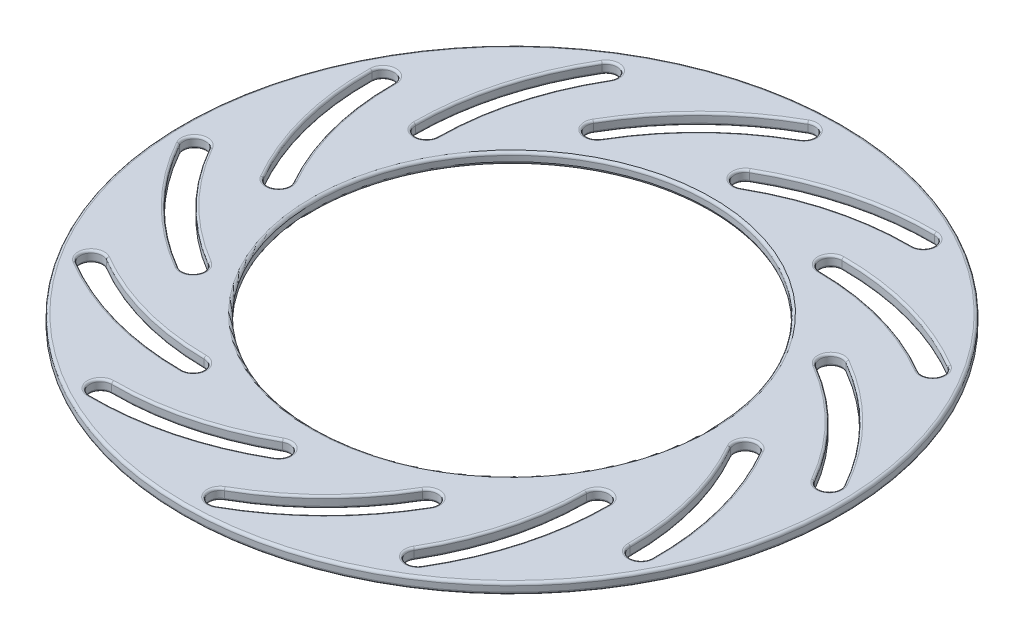
from build123d import *

# Parameters (mm, degrees)
SKETCH_1_R                       = 60
SKETCH_1_R_2                     = 36
EXTRUDE_1_DEPTH                  = 1
CUT_EXTRUDE_1_DEPTH              = 85.876380696
FILLET_2_R                       = 0.4
PATTERN_CIRCULAR_1_COUNT         = 12
FILLET_2_OF_PATTERN_CIRCULAR_1_R = 0.4
FILLET_1_R                       = 0.5


with BuildPart() as part:
    # Эскиз1 → Бобышка-Вытянуть1 (new, symmetric)
    with BuildSketch(Plane(origin=(0, 0, 0), x_dir=(1, 0, 0), z_dir=(0, 1, 0))):
        with Locations(Location((0, 0, 0), (0, 0, 270))):
            Circle(SKETCH_1_R)
        with Locations(Location((0, 0, 0), (0, 0, 270))):
            Circle(SKETCH_1_R_2, mode=Mode.SUBTRACT)
    extrude(amount=EXTRUDE_1_DEPTH, both=True)

    # Эскиз2 → Вырез-Вытянуть1 (cut, through all)
    with BuildSketch(Plane(origin=(0, 1, 0), x_dir=(1, 0, 0), z_dir=(0, 1, 0))):
        with BuildLine():
            ThreePointArc((-1, 44.232050808), (-1.734695442, 41.504594694), (0.990803619, 40.762672112))
            ThreePointArc((0.990803619, 40.762672112), (12.908045968, 45.613674132), (25.677365486, 47.193979435))
            ThreePointArc((25.677365486, 47.193979435), (27.694418732, 49.171424871), (25.722326885, 51.193712683))
            ThreePointArc((25.722326885, 51.193712683), (11.890599802, 49.519139452), (-1, 44.232050808))
        make_face()
    cut_extrude_1 = extrude(amount=-CUT_EXTRUDE_1_DEPTH, mode=Mode.SUBTRACT)

    # Скругление2
    fillet_2_edges = [part.edges().sort_by_distance(p)[0] for p in [
        (11.890599802, -1, -49.519139452),
        (27.694418732, -1, -49.171424871),
        (12.908045968, -1, -45.613674132),
        (-1.734695442, -1, -41.504594694),
        (11.890599802, 1, -49.519139452),
        (-1.734695442, 1, -41.504594694),
        (12.908045968, 1, -45.613674132),
        (27.694418732, 1, -49.171424871),
    ]]
    fillet(fillet_2_edges, radius=FILLET_2_R)

    # Круговой массив1: Вырез-Вытянуть1 ×12 about axis
    pattern_circular_1_axis = Axis((0, 0, 0), (0, 1, 0))
    for i in range(1, PATTERN_CIRCULAR_1_COUNT):
        add(cut_extrude_1.rotate(pattern_circular_1_axis, i * 360 / PATTERN_CIRCULAR_1_COUNT), mode=Mode.SUBTRACT)

    # Скругление2 of Круговой массив1
    fillet_2_of_pattern_circular_1_edges = [part.edges().sort_by_distance(p)[0] for p in [
        (-14.462008231, -1, -48.83013264),
        (-0.601642271, -1, -56.430912444),
        (-11.628141345, -1, -45.956623542),
        (-22.254587667, -1, -35.076685658),
        (-14.462008231, 1, -48.83013264),
        (-22.254587667, 1, -35.076685658),
        (-11.628141345, 1, -45.956623542),
        (-0.601642271, 1, -56.430912444),
        (-36.939532838, -1, -35.057131221),
        (-28.736493713, -1, -48.5697826),
        (-33.048577574, -1, -33.985532787),
        (-36.811381099, -1, -19.250007026),
        (-36.939532838, 1, -35.057131221),
        (-36.811381099, 1, -19.250007026),
        (-33.048577574, 1, -33.985532787),
        (-28.736493713, 1, -48.5697826),
        (-49.519139452, -1, -11.890599802),
        (-49.171424871, -1, -27.694418732),
        (-45.613674132, -1, -12.908045968),
        (-41.504594694, -1, 1.734695442),
        (-49.519139452, 1, -11.890599802),
        (-41.504594694, 1, 1.734695442),
        (-45.613674132, 1, -12.908045968),
        (-49.171424871, 1, -27.694418732),
        (-48.83013264, -1, 14.462008231),
        (-56.430912444, -1, 0.601642271),
        (-45.956623542, -1, 11.628141345),
        (-35.076685658, -1, 22.254587667),
        (-48.83013264, 1, 14.462008231),
        (-35.076685658, 1, 22.254587667),
        (-45.956623542, 1, 11.628141345),
        (-56.430912444, 1, 0.601642271),
        (-35.057131221, -1, 36.939532838),
        (-48.5697826, -1, 28.736493713),
        (-33.985532787, -1, 33.048577574),
        (-19.250007026, -1, 36.811381099),
        (-35.057131221, 1, 36.939532838),
        (-19.250007026, 1, 36.811381099),
        (-33.985532787, 1, 33.048577574),
        (-48.5697826, 1, 28.736493713),
        (-11.890599802, -1, 49.519139452),
        (-27.694418732, -1, 49.171424871),
        (-12.908045968, -1, 45.613674132),
        (1.734695442, -1, 41.504594694),
        (-11.890599802, 1, 49.519139452),
        (1.734695442, 1, 41.504594694),
        (-12.908045968, 1, 45.613674132),
        (-27.694418732, 1, 49.171424871),
        (14.462008231, -1, 48.83013264),
        (0.601642271, -1, 56.430912444),
        (11.628141345, -1, 45.956623542),
        (22.254587667, -1, 35.076685658),
        (14.462008231, 1, 48.83013264),
        (22.254587667, 1, 35.076685658),
        (11.628141345, 1, 45.956623542),
        (0.601642271, 1, 56.430912444),
        (36.939532838, -1, 35.057131221),
        (28.736493713, -1, 48.5697826),
        (33.048577574, -1, 33.985532787),
        (36.811381099, -1, 19.250007026),
        (36.939532838, 1, 35.057131221),
        (36.811381099, 1, 19.250007026),
        (33.048577574, 1, 33.985532787),
        (28.736493713, 1, 48.5697826),
        (49.519139452, -1, 11.890599802),
        (49.171424871, -1, 27.694418732),
        (45.613674132, -1, 12.908045968),
        (41.504594694, -1, -1.734695442),
        (49.519139452, 1, 11.890599802),
        (41.504594694, 1, -1.734695442),
        (45.613674132, 1, 12.908045968),
        (49.171424871, 1, 27.694418732),
        (48.83013264, -1, -14.462008231),
        (56.430912444, -1, -0.601642271),
        (45.956623542, -1, -11.628141345),
        (35.076685658, -1, -22.254587667),
        (48.83013264, 1, -14.462008231),
        (35.076685658, 1, -22.254587667),
        (45.956623542, 1, -11.628141345),
        (56.430912444, 1, -0.601642271),
        (35.057131221, -1, -36.939532838),
        (48.5697826, -1, -28.736493713),
        (33.985532787, -1, -33.048577574),
        (19.250007026, -1, -36.811381099),
        (35.057131221, 1, -36.939532838),
        (19.250007026, 1, -36.811381099),
        (33.985532787, 1, -33.048577574),
        (48.5697826, 1, -28.736493713),
    ]]
    fillet(fillet_2_of_pattern_circular_1_edges, radius=FILLET_2_OF_PATTERN_CIRCULAR_1_R)

    # Скругление1
    fillet_1_edges = [part.edges().sort_by_distance(p)[0] for p in [
        (0, -1, -60),
        (0, 1, -60),
        (0, -1, -36),
        (0, 1, -36),
    ]]
    fillet(fillet_1_edges, radius=FILLET_1_R)


solid = part.part
